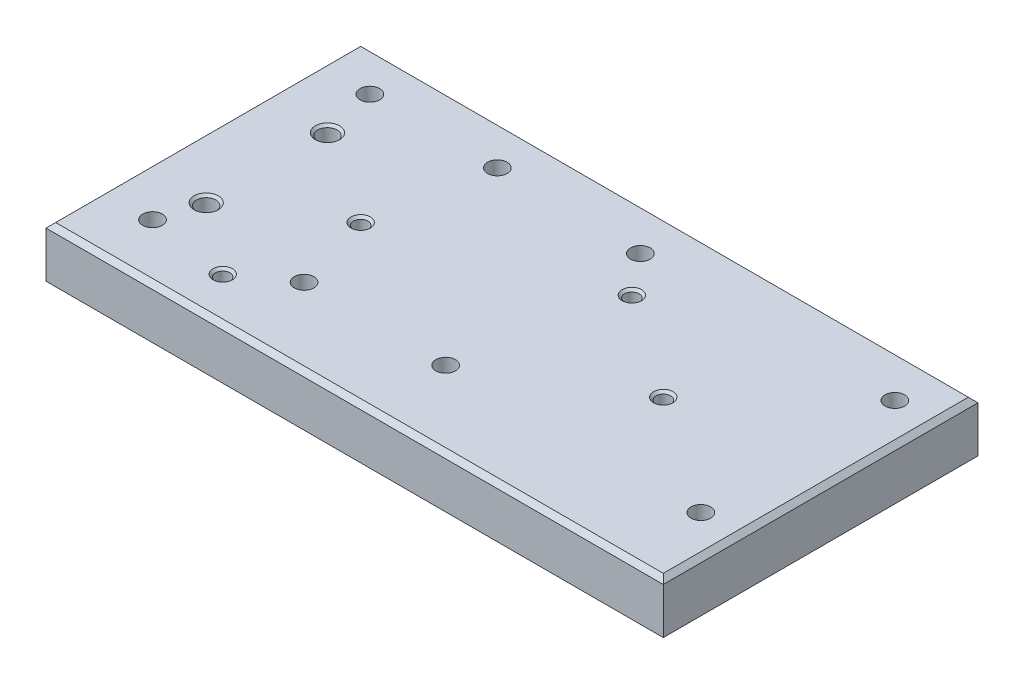
from build123d import *

# Parameters (mm, degrees)
SKETCH1_W           = 255
SKETCH1_H           = 130
SKETCH1_R           = 4.05
SKETCH1_R_2         = 4
SKETCH1_R_3         = 3
BOSS_EXTRUDE1_DEPTH = 21
CHAMFER1_SIZE       = 2
CHAMFER5_SIZE       = 1
CHAMFER6_SIZE       = 1


with BuildPart() as part:
    # Sketch1 → Boss-Extrude1 (new body)
    with BuildSketch(Plane(origin=(0, 0, 0), x_dir=(1, 0, 0), z_dir=(0, 1, 0))):
        with Locations((127.5, 65)):
            Rectangle(SKETCH1_W, SKETCH1_H)
        with Locations(Location((73.68, 112.78, 0), (0, 0, 270))):
            Circle(SKETCH1_R, mode=Mode.SUBTRACT)
        with Locations(Location((133.87, 111.67, 0), (0, 0, 270))):
            Circle(SKETCH1_R, mode=Mode.SUBTRACT)
        with Locations(Location((133.61, 31.48, 0), (0, 0, 270))):
            Circle(SKETCH1_R, mode=Mode.SUBTRACT)
        with Locations(Location((74.69, 31.92, 0), (0, 0, 270))):
            Circle(SKETCH1_R, mode=Mode.SUBTRACT)
        with Locations(Location((26.03, 90.25, 0), (0, 0, 270))):
            Circle(SKETCH1_R_2, mode=Mode.SUBTRACT)
        with Locations(Location((26.03, 40.14, 0), (0, 0, 270))):
            Circle(SKETCH1_R_2, mode=Mode.SUBTRACT)
        with Locations(Location((21, 112.78, 0), (0, 0, 270))):
            Circle(SKETCH1_R, mode=Mode.SUBTRACT)
        with Locations(Location((239, 111.67, 0), (0, 0, 270))):
            Circle(SKETCH1_R, mode=Mode.SUBTRACT)
        with Locations(Location((239, 31.48, 0), (0, 0, 270))):
            Circle(SKETCH1_R, mode=Mode.SUBTRACT)
        with Locations(Location((21, 23, 0), (0, 0, 270))):
            Circle(SKETCH1_R, mode=Mode.SUBTRACT)
        with Locations(Location((65, 65, 0), (0, 0, 270))):
            Circle(SKETCH1_R_3, mode=Mode.SUBTRACT)
        with Locations(Location((190, 65, 0), (0, 0, 270))):
            Circle(SKETCH1_R_3, mode=Mode.SUBTRACT)
        with Locations(Location((147, 95, 0), (0, 0, 270))):
            Circle(SKETCH1_R_3, mode=Mode.SUBTRACT)
        with Locations(Location((55, 18, 0), (0, 0, 270))):
            Circle(SKETCH1_R_3, mode=Mode.SUBTRACT)
    extrude(amount=-BOSS_EXTRUDE1_DEPTH)

    # Chamfer1
    chamfer1_edges = [part.edges().sort_by_distance(p)[0] for p in [
        (127.5, 0, -130),
        (255, 0, -65),
        (127.5, 0, 0),
        (0, 0, -65),
    ]]
    chamfer(chamfer1_edges, length=CHAMFER1_SIZE)

    # Chamfer5
    chamfer5_edges = [part.edges().sort_by_distance(p)[0] for p in [
        (65, 0, -68),
        (190, 0, -68),
        (147, 0, -98),
        (55, 0, -21),
    ]]
    chamfer(chamfer5_edges, length=CHAMFER5_SIZE)

    # Chamfer6
    chamfer6_edges = [part.edges().sort_by_distance(p)[0] for p in [
        (26.03, 0, -94.25),
        (26.03, 0, -44.14),
    ]]
    chamfer(chamfer6_edges, length=CHAMFER6_SIZE)


solid = part.part
